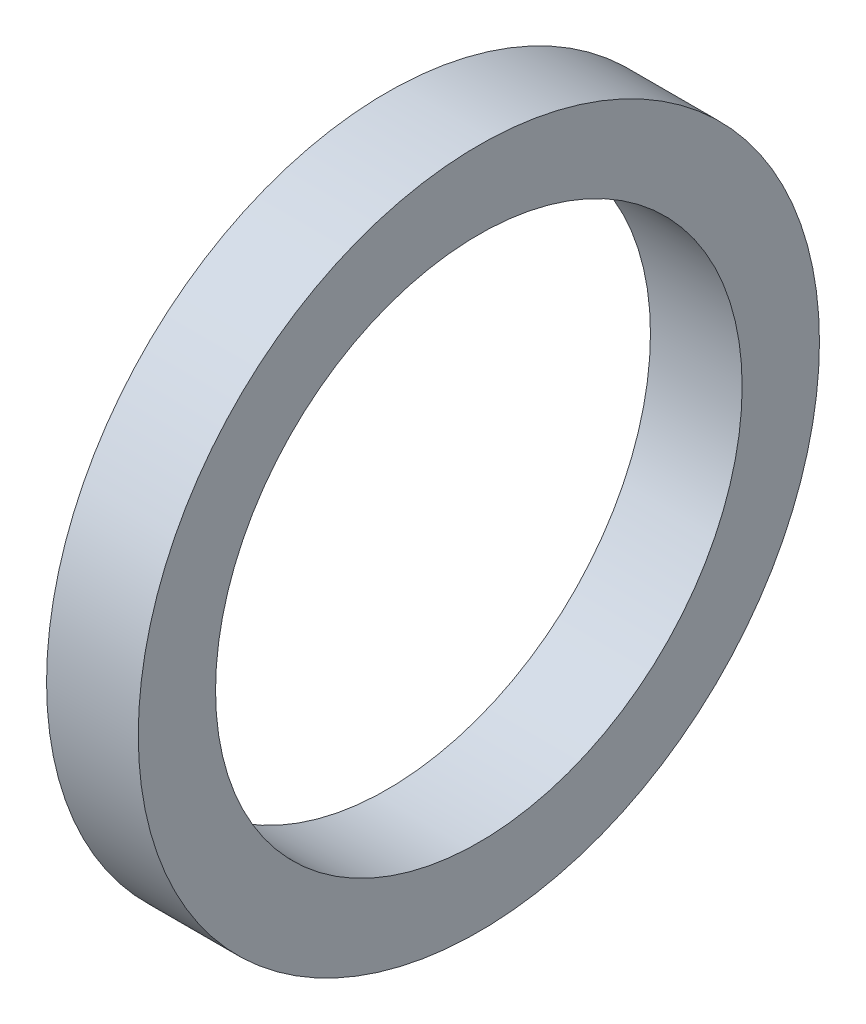
from build123d import *

# Parameters (mm, degrees)
SKETCH1_R           = 26
SKETCH1_R_2         = 20.1
BOSS_EXTRUDE1_DEPTH = 7


with BuildPart() as part:
    # Sketch1 → Boss-Extrude1 (new body)
    with BuildSketch(Plane(origin=(0, 0, 0), x_dir=(0, 0, -1), z_dir=(1, 0, 0))):
        Circle(SKETCH1_R)
        Circle(SKETCH1_R_2, mode=Mode.SUBTRACT)
    extrude(amount=BOSS_EXTRUDE1_DEPTH)


solid = part.part
